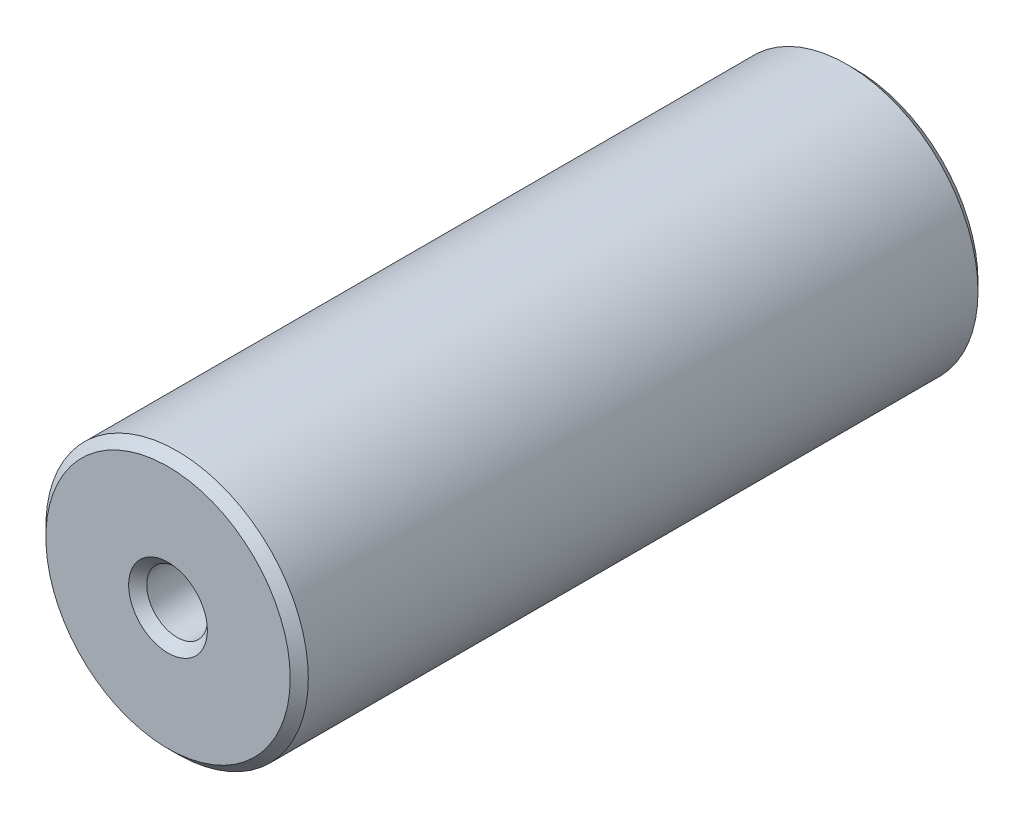
from build123d import *

# Parameters (mm, degrees)
ESQUISSE1_R        = 14.5
ESQUISSE1_R_2      = 3.35
BOSS_EXTRU_1_DEPTH = 76
CHANFREIN1_SIZE    = 1


with BuildPart() as part:
    # Esquisse1 → Boss.-Extru.1 (new body)
    with BuildSketch(Plane.XY):
        Circle(ESQUISSE1_R)
        Circle(ESQUISSE1_R_2, mode=Mode.SUBTRACT)
    extrude(amount=BOSS_EXTRU_1_DEPTH)

    # Chanfrein1
    chanfrein1_edges = [part.edges().sort_by_distance(p)[0] for p in [
        (-14.5, 0, 0),
        (-14.5, 0, 76),
        (-3.35, 0, 0),
        (-3.35, 0, 76),
    ]]
    chamfer(chanfrein1_edges, length=CHANFREIN1_SIZE)


solid = part.part
